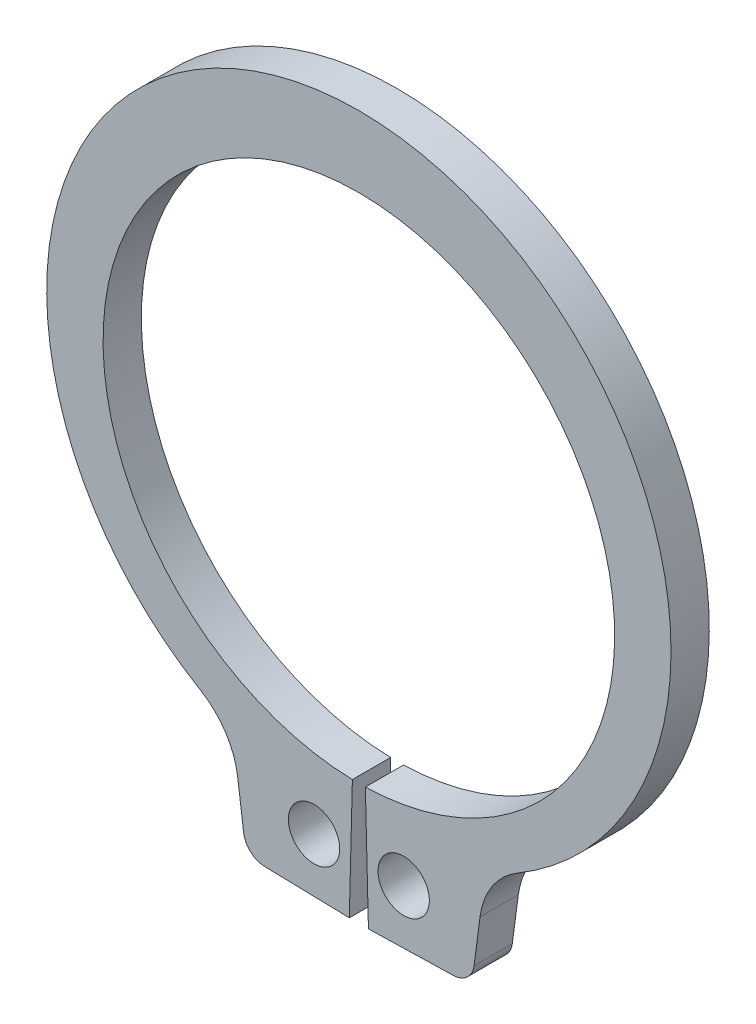
from build123d import *

# Parameters (mm, degrees)
BODYSKE_R  = 0.5969
BODY_DEPTH = 0.889


with BuildPart() as part:
    # BodySke → Body (new body)
    with BuildSketch(Plane.XY):
        with BuildLine():
            Line((0.150743478, -5.94168809), (0.22225, -8.760181159))
            Line((0.22225, -8.760181159), (2.193500812, -8.71016958))
            ThreePointArc((2.193500812, -8.71016958), (2.51523353, -8.582039118), (2.676542083, -8.275593514))
            Line((2.676542083, -8.275593514), (2.815320055, -7.221470159))
            ThreePointArc((2.815320055, -7.221470159), (3.098962326, -6.462334391), (3.686440324, -5.904114314))
            ThreePointArc((3.686440324, -5.904114314), (0, 7.5946), (-3.686440324, -5.904114314))
            ThreePointArc((-3.686440324, -5.904114314), (-3.098962326, -6.462334391), (-2.815320055, -7.221470159))
            Line((-2.815320055, -7.221470159), (-2.676542083, -8.275593514))
            ThreePointArc((-2.676542083, -8.275593514), (-2.51523353, -8.582039118), (-2.193500812, -8.71016958))
            Line((-2.193500812, -8.71016958), (-0.22225, -8.760181159))
            Line((-0.22225, -8.760181159), (-0.150743478, -5.94168809))
            ThreePointArc((-0.150743478, -5.94168809), (0, 5.9436), (0.150743478, -5.94168809))
        make_face()
        with Locations((1.0414, -7.484395653)):
            Circle(BODYSKE_R, mode=Mode.SUBTRACT)
        with Locations((-1.0414, -7.484395653)):
            Circle(BODYSKE_R, mode=Mode.SUBTRACT)
    extrude(amount=-BODY_DEPTH)


solid = part.part
